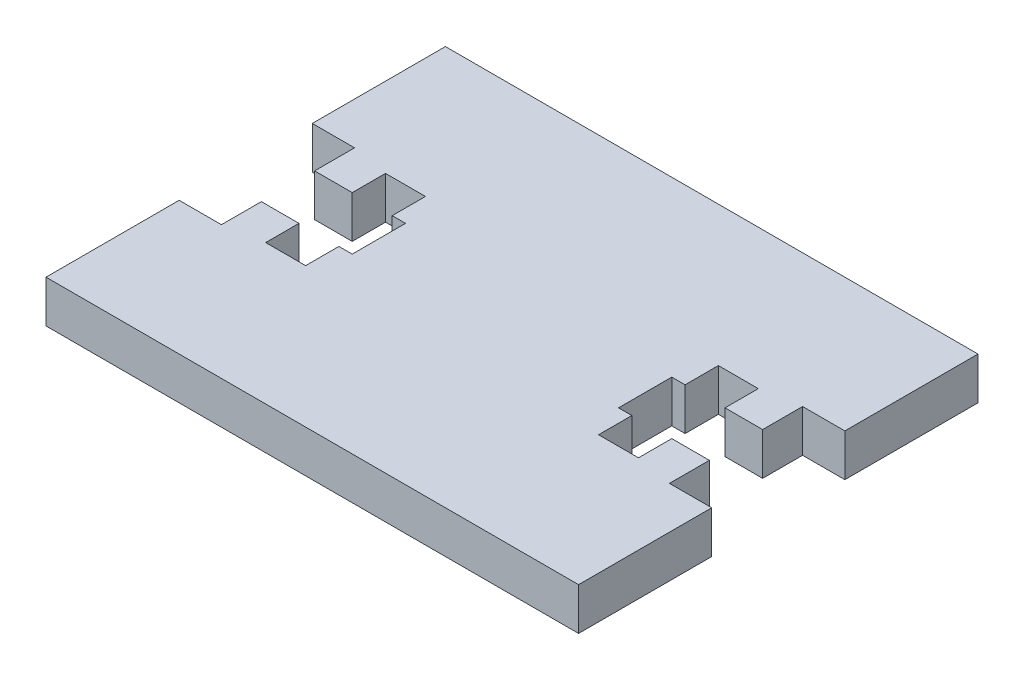
from build123d import *

# Parameters (mm, degrees)
BOSS_EXTRUDE1_DEPTH = 3.175


with BuildPart() as part:
    # Sketch2 → Boss-Extrude1 (new body)
    with BuildSketch(Plane(origin=(0, 0, 0), x_dir=(1, 0, 0), z_dir=(0, 1, 0))):
        Polygon((20, 20), (20, 30), (0, 30), (0, 0), (20, 0), (20, 10), (16.825, 10), (16.825, 13), (14, 13), (14, 10.5), (11, 10.5), (11, 13), (10, 13), (10, 17), (11, 17), (11, 19.5), (14, 19.5), (14, 17), (16.825, 17), (16.825, 20), align=None)
    boss_extrude1 = extrude(amount=BOSS_EXTRUDE1_DEPTH)

    # Mirror1: Boss-Extrude1 across plane
    add(boss_extrude1.mirror(Plane(origin=(0, 3.175, 0), x_dir=(0, 0, 1), z_dir=(1, 0, 0))))


solid = part.part
